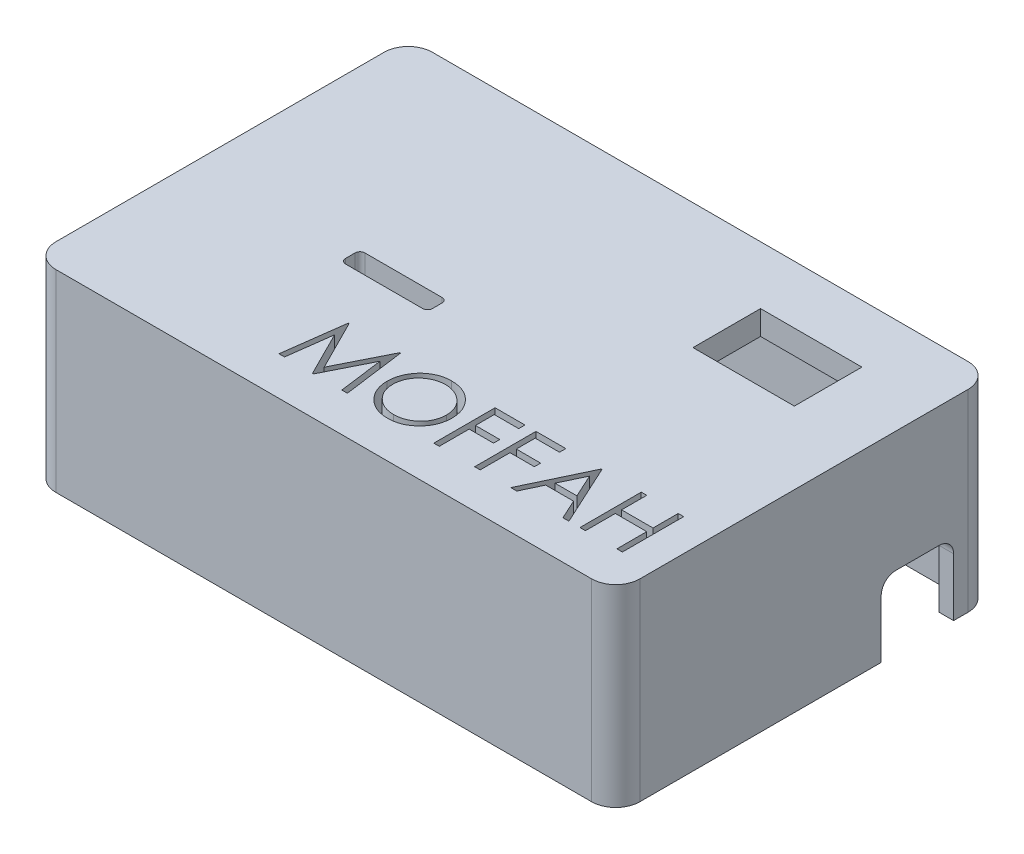
from build123d import *

# Parameters (mm, degrees)
SALIENTE_EXTRUIR1_DEPTH    = 35
SALIENTE_EXTRUIR2_DEPTH    = 5
CORTAR_EXTRUIR1_DEPTH      = 83.34834546
CORTAR_EXTRUIR1_DEPTH_BACK = 83.34834546
CORTAR_EXTRUIR3_DEPTH      = 3
CROQUIS7_W                 = 21
CROQUIS7_H                 = 14
CORTAR_EXTRUIR4_DEPTH      = 10
CORTAR_EXTRUIR5_DEPTH      = 10


with BuildPart() as part:
    # Croquis1 → Saliente-Extruir1 (new body)
    with BuildSketch(Plane(origin=(0, 0, 0), x_dir=(1, 0, 0), z_dir=(0, 1, 0))):
        with BuildLine():
            Line((-60.5, 34), (-60.5, -34))
            ThreePointArc((-60.5, -34), (-59.035533906, -37.535533906), (-55.5, -39))
            Line((-55.5, -39), (55.5, -39))
            ThreePointArc((55.5, -39), (59.035533906, -37.535533906), (60.5, -34))
            Line((60.5, -34), (60.5, 34))
            ThreePointArc((60.5, 34), (59.035533906, 37.535533906), (55.5, 39))
            Line((55.5, 39), (-55.5, 39))
            ThreePointArc((-55.5, 39), (-59.035533906, 37.535533906), (-60.5, 34))
        make_face()
        with BuildLine():
            Line((-55.5, 36), (55.5, 36))
            ThreePointArc((55.5, 36), (56.914213562, 35.414213562), (57.5, 34))
            Line((57.5, 34), (57.5, -34))
            ThreePointArc((57.5, -34), (56.914213562, -35.414213562), (55.5, -36))
            Line((55.5, -36), (-55.5, -36))
            ThreePointArc((-55.5, -36), (-56.914213562, -35.414213562), (-57.5, -34))
            Line((-57.5, -34), (-57.5, 34))
            ThreePointArc((-57.5, 34), (-56.914213562, 35.414213562), (-55.5, 36))
        make_face(mode=Mode.SUBTRACT)
    extrude(amount=SALIENTE_EXTRUIR1_DEPTH)

    # Croquis3 → Saliente-Extruir2 (add)
    with BuildSketch(Plane(origin=(0, 35, 0), x_dir=(1, 0, 0), z_dir=(0, 1, 0))):
        with BuildLine():
            Line((55.5, 39), (-55.5, 39))
            ThreePointArc((-55.5, 39), (-59.035533906, 37.535533906), (-60.5, 34))
            Line((-60.5, 34), (-60.5, -34))
            ThreePointArc((-60.5, -34), (-59.035533906, -37.535533906), (-55.5, -39))
            Line((-55.5, -39), (55.5, -39))
            ThreePointArc((55.5, -39), (59.035533906, -37.535533906), (60.5, -34))
            Line((60.5, -34), (60.5, 34))
            ThreePointArc((60.5, 34), (59.035533906, 37.535533906), (55.5, 39))
        make_face()
    extrude(amount=SALIENTE_EXTRUIR2_DEPTH)

    # Croquis5 → Cortar-Extruir1 (cut, two sides: drawn at the far end of the back side and taken through both)
    # profile 1 of 6: a face of its own
    with BuildSketch(Plane(origin=(0, 40, 0), x_dir=(1, 0, 0), z_dir=(0, 1, 0)).offset(-CORTAR_EXTRUIR1_DEPTH_BACK)):
        Polygon((45.079487179, -18.3), (46.219230769, -18.3), (46.219230769, -23.51025641), (52.732051282, -23.51025641), (52.732051282, -18.3), (53.871794872, -18.3), (53.871794872, -31), (52.732051282, -31), (52.732051282, -24.812820513), (46.219230769, -24.812820513), (46.219230769, -31), (45.079487179, -31), align=None)
    # profile 2 of 6: a face of its own
    with BuildSketch(Plane(origin=(0, 40, 0), x_dir=(1, 0, 0), z_dir=(0, 1, 0)).offset(-CORTAR_EXTRUIR1_DEPTH_BACK)):
        Polygon((36.938461538, -18.3), (42.8, -31), (41.56103766, -31), (39.683513622, -26.929487179), (33.926282051, -26.929487179), (31.995332532, -31), (30.751282051, -31), (36.775641026, -18.3), align=None)
        Polygon((36.844330929, -20.775380609), (34.544491186, -25.626923077), (39.083112981, -25.626923077), align=None, mode=Mode.SUBTRACT)
    # profile 3 of 6: a face of its own
    with BuildSketch(Plane(origin=(0, 40, 0), x_dir=(1, 0, 0), z_dir=(0, 1, 0)).offset(-CORTAR_EXTRUIR1_DEPTH_BACK)):
        Polygon((23.261538462, -18.3), (29.448717949, -18.3), (29.448717949, -19.602564103), (24.401282051, -19.602564103), (24.401282051, -23.51025641), (29.448717949, -23.51025641), (29.448717949, -24.812820513), (24.401282051, -24.812820513), (24.401282051, -31), (23.261538462, -31), align=None)
    # profile 4 of 6: a face of its own
    with BuildSketch(Plane(origin=(0, 40, 0), x_dir=(1, 0, 0), z_dir=(0, 1, 0)).offset(-CORTAR_EXTRUIR1_DEPTH_BACK)):
        Polygon((14.794871795, -18.3), (20.982051282, -18.3), (20.982051282, -19.602564103), (15.934615385, -19.602564103), (15.934615385, -23.51025641), (20.982051282, -23.51025641), (20.982051282, -24.812820513), (15.934615385, -24.812820513), (15.934615385, -31), (14.794871795, -31), align=None)
    # profile 5 of 6: a face of its own
    with BuildSketch(Plane(origin=(0, 40, 0), x_dir=(1, 0, 0), z_dir=(0, 1, 0)).offset(-CORTAR_EXTRUIR1_DEPTH_BACK)):
        with BuildLine():
            add(Edge.make_bspline(
                [(5.432692308, -17.974358974), (5.667853149, -17.9803152), (6.129728444, -17.992013717), (6.808543072, -18.081563607), (7.456588132, -18.236486879), (8.079142636, -18.442818273), (8.668760008, -18.718061328), (9.229878275, -19.050747438), (9.76116236, -19.444362017), (10.255451373, -19.895862354), (10.707778021, -20.387110887), (11.106289094, -20.911359304), (11.440271132, -21.465437815), (11.714539559, -22.0476814), (11.9297088, -22.656773284), (12.078186473, -23.295960666), (12.173030618, -23.961102084), (12.184118725, -24.414770993), (12.18974359, -24.644911859)],
                knots=[0, 0, 0, 0, 1.065120563, 2.091984664, 3.0946048, 4.079830382, 5.057816894, 6.036188127, 7.030412546, 8.04752943, 9.064399622, 10.05169764, 11.02544977, 11.989514704, 12.962713494, 13.945757189, 14.957906945, 16, 16, 16, 16], degree=3))
            add(Edge.make_bspline(
                [(12.18974359, -24.644911859), (12.184119549, -24.87335745), (12.173033913, -25.323650176), (12.078078634, -25.984570673), (11.929158434, -26.619899772), (11.716537697, -27.228576855), (11.443576675, -27.811244015), (11.107370769, -28.366368104), (10.71134409, -28.894131113), (10.260650659, -29.388751355), (9.769338306, -29.842313606), (9.24235991, -30.237533526), (8.691567006, -30.577618207), (8.109871779, -30.84897611), (7.504988788, -31.065862792), (6.871504359, -31.213736621), (6.212386863, -31.309121035), (5.762912077, -31.320073936), (5.534455128, -31.325641026)],
                knots=[0, 0, 0, 0, 1.043624062, 2.057103931, 3.04512605, 4.022047818, 4.998200453, 5.980619268, 6.982898556, 8.009068085, 9.034988726, 10.034168286, 11.015286542, 11.987931943, 12.962482838, 13.94673481, 14.956375938, 16, 16, 16, 16], degree=3))
            add(Edge.make_bspline(
                [(5.534455128, -31.325641026), (5.304315456, -31.320018965), (4.850648902, -31.308936386), (4.184671659, -31.213935289), (3.545035274, -31.065376844), (2.933568914, -30.853071175), (2.349931598, -30.578688652), (1.792981869, -30.244118477), (1.264955249, -29.84712685), (0.770229483, -29.396579565), (0.317568107, -28.906099934), (-0.077073056, -28.380558494), (-0.411718467, -27.830265837), (-0.685179702, -27.253694821), (-0.901676455, -26.653632729), (-1.049376795, -26.026076825), (-1.144938678, -25.374604903), (-1.155950835, -24.931037815), (-1.161538462, -24.705969551)],
                knots=[0, 0, 0, 0, 1.053102029, 2.075944431, 3.073151272, 4.055350789, 5.033113405, 6.020478099, 7.024410459, 8.052272461, 9.079885166, 10.07527673, 11.055994387, 12.023226415, 12.992069828, 13.970394897, 14.97016774, 16, 16, 16, 16], degree=3))
            add(Edge.make_bspline(
                [(-1.161538462, -24.705969551), (-1.159598498, -24.554902438), (-1.155743046, -24.254673989), (-1.109327476, -23.808843755), (-1.041975017, -23.370183368), (-0.945448077, -22.939940214), (-0.819204029, -22.519167498), (-0.670243815, -22.104963301), (-0.488307805, -21.701525218), (-0.282638025, -21.306942054), (-0.053088035, -20.927364795), (0.200461113, -20.568573165), (0.469103735, -20.227556405), (0.763610906, -19.913151563), (1.074276293, -19.616212295), (1.406139551, -19.341301865), (1.757175695, -19.085941329), (2.128895187, -18.855816091), (2.512138642, -18.647684374), (2.907205807, -18.469079372), (3.308731081, -18.31578652), (3.718595089, -18.19154124), (4.135709433, -18.093453567), (4.56098448, -18.026661169), (4.994081427, -17.980127216), (5.285859641, -17.976289994), (5.432692308, -17.974358974)],
                knots=[0, 0, 0, 0, 1.037015668, 2.060948919, 3.074880161, 4.083647147, 5.086022904, 6.090072063, 7.104153813, 8.122640571, 9.144368836, 10.147691507, 11.138137339, 12.123020368, 13.103399296, 14.087645067, 15.080126199, 16.082011238, 17.087798457, 18.072939717, 19.057185487, 20.037253025, 21.01195951, 21.997135196, 22.992090687, 24, 24, 24, 24], degree=3))
        make_face()
        with BuildLine():
            add(Edge.make_bspline(
                [(5.488661859, -19.276923077), (5.368140189, -19.27839225), (5.128249043, -19.281316551), (4.771616583, -19.319836433), (4.419674423, -19.374736316), (4.072349881, -19.453046406), (3.731096202, -19.559741112), (3.392732493, -19.682535264), (3.060344269, -19.832108936), (2.735028842, -20.00110132), (2.419651283, -20.188150261), (2.122062338, -20.394876387), (1.841491601, -20.616431713), (1.578626034, -20.853333294), (1.334237495, -21.106787564), (1.103515864, -21.372952118), (0.895709096, -21.659434694), (0.705261432, -21.958466741), (0.534835268, -22.269658765), (0.383286695, -22.589734551), (0.259320149, -22.921305014), (0.158219527, -23.260772957), (0.074400213, -23.607600739), (0.021299974, -23.964419391), (-0.017643159, -24.32943594), (-0.020400312, -24.576112954), (-0.021794872, -24.70088141)],
                knots=[0, 0, 0, 0, 1.008559885, 2.007477868, 2.99961109, 3.989939068, 4.984837346, 5.991145699, 7.001802488, 8.033829008, 9.059044045, 10.069351652, 11.065060232, 12.050310815, 13.029377138, 14.011219647, 14.996725999, 15.989392538, 16.977580475, 17.965360261, 18.951710183, 19.937753436, 20.929683414, 21.935841486, 22.955955122, 24, 24, 24, 24], degree=3))
            add(Edge.make_bspline(
                [(-0.021794872, -24.70088141), (-0.017168944, -24.88435004), (-0.008068313, -25.245289593), (0.071606298, -25.774219715), (0.194331748, -26.282540068), (0.375242764, -26.767469282), (0.601486423, -27.23317568), (0.880983996, -27.675527945), (1.212124106, -28.094645632), (1.588274617, -28.487602751), (1.999474153, -28.846271812), (2.436110058, -29.161099038), (2.893504577, -29.427473373), (3.372850484, -29.64448035), (3.871588697, -29.816437398), (4.392932954, -29.934288431), (4.933410336, -30.011850798), (5.30182157, -30.019299369), (5.488661859, -30.023076923)],
                knots=[0, 0, 0, 0, 1.032063989, 2.030389145, 3.003944642, 3.970395727, 4.937377036, 5.913328081, 6.909231446, 7.93887556, 8.970685674, 9.976071282, 10.964166581, 11.944589148, 12.933237628, 13.927779006, 14.949070134, 16, 16, 16, 16], degree=3))
            add(Edge.make_bspline(
                [(5.488661859, -30.023076923), (5.614244908, -30.021351522), (5.863313811, -30.017929532), (6.233774706, -29.983462905), (6.597561532, -29.928192978), (6.954164033, -29.848616028), (7.303177492, -29.749021879), (7.646058634, -29.630702409), (7.979155288, -29.483087756), (8.306669556, -29.319990903), (8.620164491, -29.134062331), (8.919432851, -28.934352474), (9.196931406, -28.713123479), (9.459600322, -28.479741702), (9.704992222, -28.229501454), (9.931447679, -27.962728077), (10.138204159, -27.677737693), (10.328579505, -27.37915922), (10.498408487, -27.067115675), (10.646378361, -26.745879415), (10.771912838, -26.416241447), (10.873253413, -26.077726316), (10.952666374, -25.73097695), (11.007384941, -25.375529067), (11.045660704, -25.012093738), (11.048545698, -24.766280318), (11.05, -24.642367788)],
                knots=[0, 0, 0, 0, 1.047197238, 2.076906641, 3.100256066, 4.114471768, 5.12198147, 6.126382909, 7.136867548, 8.15857795, 9.17633901, 10.174870724, 11.156907918, 12.133735059, 13.104061851, 14.077631395, 15.04955518, 16.038496417, 17.029181396, 18.010275684, 18.986308667, 19.968651475, 20.955262928, 21.950658345, 22.966943676, 24, 24, 24, 24], degree=3))
            add(Edge.make_bspline(
                [(11.05, -24.642367788), (11.048544533, -24.519302959), (11.045657346, -24.275181199), (11.007403224, -23.914280516), (10.952608564, -23.561390291), (10.873641024, -23.21789592), (10.771859037, -22.883709844), (10.646356438, -22.559145931), (10.498364066, -22.242995051), (10.32851708, -21.936038602), (10.137596807, -21.641490267), (9.928974838, -21.35990437), (9.699049146, -21.096568995), (9.454388999, -20.844983105), (9.188883215, -20.610512477), (8.903734491, -20.393079331), (8.602404574, -20.187436307), (8.28335432, -20.001923554), (7.954083402, -19.830603338), (7.616212755, -19.683823984), (7.273570022, -19.559102293), (6.927026528, -19.452723591), (6.573665436, -19.375043025), (6.2158744, -19.319786958), (5.854148433, -19.281329958), (5.610877321, -19.278396699), (5.488661859, -19.276923077)],
                knots=[0, 0, 0, 0, 1.02996197, 2.043119294, 3.035359645, 4.018872909, 4.991431989, 5.957985074, 6.929999688, 7.912076566, 8.892894881, 9.867085534, 10.843653904, 11.817741046, 12.803660682, 13.806313499, 14.818574707, 15.856120519, 16.894564902, 17.924820532, 18.937903209, 19.946497019, 20.957711757, 21.963978472, 22.977135795, 24, 24, 24, 24], degree=3))
        make_face(mode=Mode.SUBTRACT)
    # profile 6 of 6: a face of its own
    with BuildSketch(Plane(origin=(0, 40, 0), x_dir=(1, 0, 0), z_dir=(0, 1, 0)).offset(-CORTAR_EXTRUIR1_DEPTH_BACK)):
        Polygon((-17.280769231, -31), (-15.604226763, -18.3), (-15.44140625, -18.3), (-10.198076923, -28.720512821), (-4.967467949, -18.3), (-4.802103365, -18.3), (-3.115384615, -31), (-4.260216346, -31), (-5.476282051, -21.861698718), (-10.060697115, -31), (-10.317648237, -31), (-14.919871795, -21.841346154), (-16.133393429, -31), align=None)
    extrude(amount=CORTAR_EXTRUIR1_DEPTH + CORTAR_EXTRUIR1_DEPTH_BACK, mode=Mode.SUBTRACT)


with BuildPart() as cortar_extruir1_piece_1:
    # of the separate pieces the step leaves, piece 1, a body of its own (cortar_extruir1_pieces)
    add(part.part.solids().sort_by_distance((55.5, 40, -39))[0])

    # Croquis6 → Cortar-Extruir3 (cut)
    with BuildSketch(Plane.ZY.offset(60.5)):
        with BuildLine():
            Line((-12.5, 0), (12.5, 0))
            Line((12.5, 0), (12.5, 5))
            ThreePointArc((12.5, 5), (9.571067812, 12.071067812), (2.5, 15))
            Line((2.5, 15), (-2.5, 15))
            ThreePointArc((-2.5, 15), (-9.571067812, 12.071067812), (-12.5, 5))
            Line((-12.5, 5), (-12.5, 0))
        make_face()
    extrude(amount=-CORTAR_EXTRUIR3_DEPTH, mode=Mode.SUBTRACT)

    # Croquis7 → Cortar-Extruir4 (cut)
    with BuildSketch(Plane(origin=(0, 40, 0), x_dir=(1, 0, 0), z_dir=(0, 1, 0))):
        with BuildLine():
            Line((-26.5, -8), (-10.5, -8))
            ThreePointArc((-10.5, -8), (-9.792893219, -7.707106781), (-9.5, -7))
            Line((-9.5, -7), (-9.5, -5))
            ThreePointArc((-9.5, -5), (-9.792893219, -4.292893219), (-10.5, -4))
            Line((-10.5, -4), (-26.5, -4))
            ThreePointArc((-26.5, -4), (-27.207106781, -4.292893219), (-27.5, -5))
            Line((-27.5, -5), (-27.5, -7))
            ThreePointArc((-27.5, -7), (-27.207106781, -7.707106781), (-26.5, -8))
        make_face()
        with Locations((35, 20)):
            Rectangle(CROQUIS7_W, CROQUIS7_H)
    extrude(amount=-CORTAR_EXTRUIR4_DEPTH, mode=Mode.SUBTRACT)

    # Croquis9 → Cortar-Extruir5 (cut)
    with BuildSketch(Plane(origin=(60.5, 0, 0), x_dir=(0, 0, -1), z_dir=(1, 0, 0))):
        with BuildLine():
            Line((16, 0), (31, 0))
            Line((31, 0), (31, 12))
            ThreePointArc((31, 12), (30.121320344, 14.121320344), (28, 15))
            Line((28, 15), (19, 15))
            ThreePointArc((19, 15), (16.878679656, 14.121320344), (16, 12))
            Line((16, 12), (16, 0))
        make_face()
    extrude(amount=-CORTAR_EXTRUIR5_DEPTH, mode=Mode.SUBTRACT)


with BuildPart() as cortar_extruir1_piece_2:
    # of the separate pieces the step leaves, piece 2, a body of its own (cortar_extruir1_pieces)
    add(part.part.solids().sort_by_distance((5.488661859, 40, 30.023076923))[0])


with BuildPart() as cortar_extruir1_piece_3:
    # of the separate pieces the step leaves, piece 3, a body of its own (cortar_extruir1_pieces)
    add(part.part.solids().sort_by_distance((36.844330929, 40, 20.775380609))[0])


solid = Compound([cortar_extruir1_piece_1.part, cortar_extruir1_piece_2.part, cortar_extruir1_piece_3.part])
